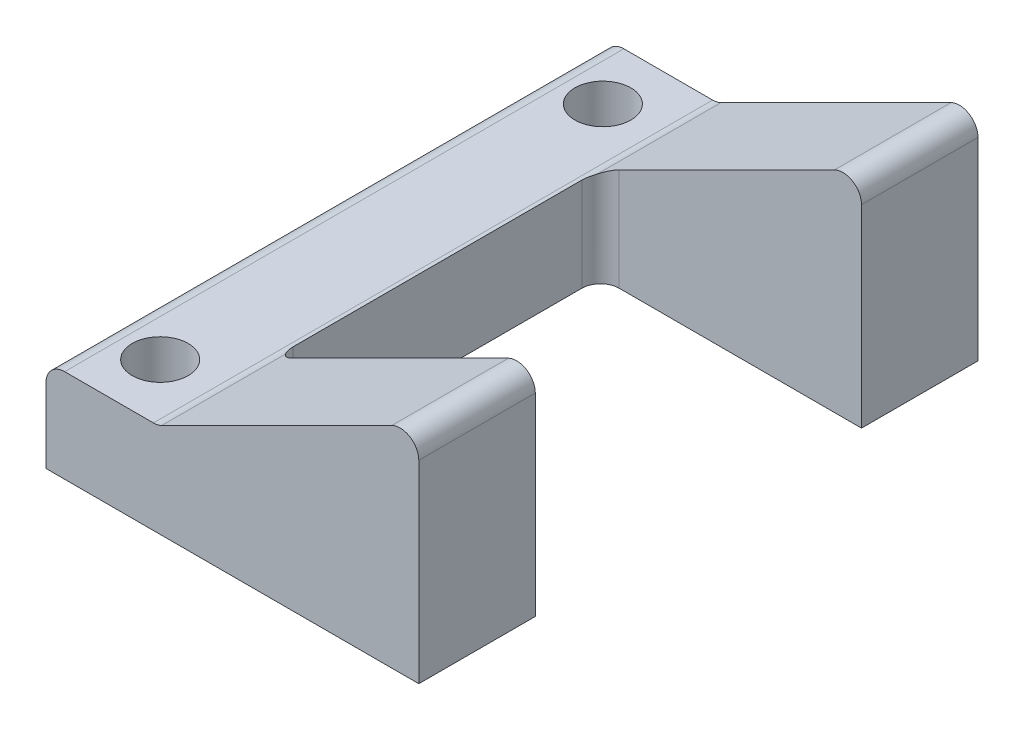
from build123d import *

# Parameters (mm, degrees)
BOSS_EXTRUDE1_DEPTH = 15
SKETCH2_R           = 1.5
CUT_EXTRUDE1_DEPTH  = 30


with BuildPart() as part:
    # Sketch1 → Boss-Extrude1 (new, symmetric)
    with BuildSketch(Plane.XY):
        with BuildLine():
            Line((0, 0), (0, 4))
            ThreePointArc((0, 4), (0.292893219, 4.707106781), (1, 5))
            Line((1, 5), (5.763932023, 5))
            ThreePointArc((5.763932023, 5), (5.993684943, 5.026751011), (6.211145618, 5.105572809))
            Line((6.211145618, 5.105572809), (18.552786405, 11.276393202))
            ThreePointArc((18.552786405, 11.276393202), (19.525731112, 11.23261682), (20, 10.381966011))
            Line((20, 10.381966011), (20, 0))
            Line((20, 0), (0, 0))
        make_face()
    extrude(amount=BOSS_EXTRUDE1_DEPTH, both=True)

    # Sketch2 → Cut-Extrude1 (cut)
    with BuildSketch(Plane.XZ):
        with Locations((3, 11.875)):
            Circle(SKETCH2_R)
        with Locations((3, -11.875)):
            Circle(SKETCH2_R)
        with BuildLine():
            Line((20, -8.75), (20, 8.75))
            Line((20, 8.75), (7, 8.75))
            ThreePointArc((7, 8.75), (6.292893219, 8.457106781), (6, 7.75))
            Line((6, 7.75), (6, -7.75))
            ThreePointArc((6, -7.75), (6.292893219, -8.457106781), (7, -8.75))
            Line((7, -8.75), (20, -8.75))
        make_face()
    extrude(amount=-CUT_EXTRUDE1_DEPTH, mode=Mode.SUBTRACT)


solid = part.part
